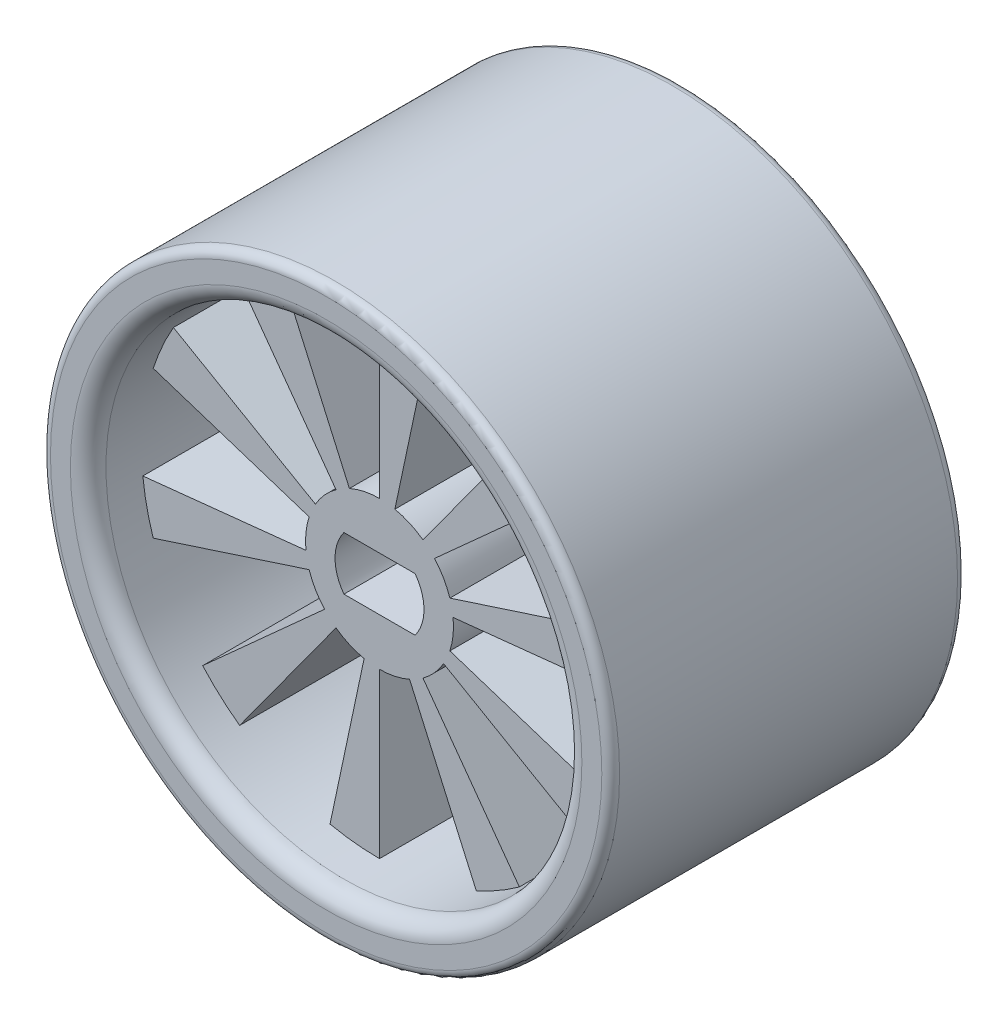
from build123d import *
from build123d.topology import SkipClean

# Parameters (mm, degrees)
SKETCH1_R           = 16
BOSS_EXTRUDE1_DEPTH = 20
CUT_EXTRUDE1_DEPTH  = 20
CUT_EXTRUDE2_DEPTH  = 20
SKETCH5_R           = 13.379368239
CUT_EXTRUDE4_DEPTH  = 3
CUT_EXTRUDE5_START  = -3
SKETCH6_R           = 13.379368239
CUT_EXTRUDE5_DEPTH  = 3
FILLET1_R           = 1
FILLET2_R           = 0.5


with BuildPart() as part:
    # Sketch1 → Boss-Extrude1 (new body)
    with BuildSketch(Plane.XY):
        Circle(SKETCH1_R)
    extrude(amount=BOSS_EXTRUDE1_DEPTH)

    # Sketch3 → Cut-Extrude1 (cut)
    with BuildSketch(Plane.XY):
        with BuildLine():
            Line((-2, 1.5), (2, 1.5))
            ThreePointArc((2, 1.5), (2.5, 0), (2, -1.5))
            Line((2, -1.5), (-2, -1.5))
            ThreePointArc((-2, -1.5), (-2.5, 0), (-2, 1.5))
        make_face()
    extrude(amount=CUT_EXTRUDE1_DEPTH, mode=Mode.SUBTRACT)

    # Sketch4 → Cut-Extrude2 (cut)
    with BuildSketch(Plane.XY):
        with BuildLine():
            Line((3.955700901, -1.285285135), (12.724535348, -4.13445216))
            ThreePointArc((12.724535348, -4.13445216), (13.30607466, -1.398524802), (13.30607466, 1.398524802))
            Line((13.30607466, 1.398524802), (4.136485151, 0.434762108))
            ThreePointArc((4.136485151, 0.434762108), (4.136485151, -0.434762108), (3.955700901, -1.285285135))
        make_face()
        with BuildLine():
            Line((3.090940028, 2.783094902), (9.942808275, 8.952544783))
            ThreePointArc((9.942808275, 8.952544783), (11.586872782, 6.68968412), (12.724535348, 4.13445216))
            Line((12.724535348, 4.13445216), (3.955700901, 1.285285135))
            ThreePointArc((3.955700901, 1.285285135), (3.602033539, 2.079635034), (3.090940028, 2.783094902))
        make_face()
        with BuildLine():
            Line((2.444757606, -3.364920169), (7.864195336, -10.82413628))
            ThreePointArc((7.864195336, -10.82413628), (9.942808275, -8.952544783), (11.586872782, -6.68968412))
            Line((11.586872782, -6.68968412), (3.602033539, -2.079635034))
            ThreePointArc((3.602033539, -2.079635034), (3.090940028, -2.783094902), (2.444757606, -3.364920169))
        make_face()
        with BuildLine():
            Line((0, -4.159270067), (0, -13.379368239))
            ThreePointArc((0, -13.379368239), (2.781727073, -13.086996943), (5.441879324, -12.222661081))
            Line((5.441879324, -12.222661081), (1.691727545, -3.799682277))
            ThreePointArc((1.691727545, -3.799682277), (0.864760872, -4.068380037), (0, -4.159270067))
        make_face()
        with BuildLine():
            Line((-2.444757606, -3.364920169), (-7.864195336, -10.82413628))
            ThreePointArc((-7.864195336, -10.82413628), (-5.441879324, -12.222661081), (-2.781727073, -13.086996943))
            Line((-2.781727073, -13.086996943), (-0.864760872, -4.068380037))
            ThreePointArc((-0.864760872, -4.068380037), (-1.691727545, -3.799682277), (-2.444757606, -3.364920169))
        make_face()
        with BuildLine():
            Line((-3.955700901, -1.285285135), (-12.724535348, -4.13445216))
            ThreePointArc((-12.724535348, -4.13445216), (-11.586872782, -6.68968412), (-9.942808275, -8.952544783))
            Line((-9.942808275, -8.952544783), (-3.090940028, -2.783094902))
            ThreePointArc((-3.090940028, -2.783094902), (-3.602033539, -2.079635034), (-3.955700901, -1.285285135))
        make_face()
        with BuildLine():
            Line((-3.955700901, 1.285285135), (-12.724535348, 4.13445216))
            ThreePointArc((-12.724535348, 4.13445216), (-13.30607466, 1.398524802), (-13.30607466, -1.398524802))
            Line((-13.30607466, -1.398524802), (-4.136485151, -0.434762108))
            ThreePointArc((-4.136485151, -0.434762108), (-4.136485151, 0.434762108), (-3.955700901, 1.285285135))
        make_face()
        with BuildLine():
            Line((-2.444757606, 3.364920169), (-7.864195336, 10.82413628))
            ThreePointArc((-7.864195336, 10.82413628), (-9.942808275, 8.952544783), (-11.586872782, 6.68968412))
            Line((-11.586872782, 6.68968412), (-3.602033539, 2.079635034))
            ThreePointArc((-3.602033539, 2.079635034), (-3.090940028, 2.783094902), (-2.444757606, 3.364920169))
        make_face()
        with BuildLine():
            Line((0, 4.159270067), (0, 13.379368239))
            ThreePointArc((0, 13.379368239), (-2.781727073, 13.086996943), (-5.441879324, 12.222661081))
            Line((-5.441879324, 12.222661081), (-1.691727545, 3.799682277))
            ThreePointArc((-1.691727545, 3.799682277), (-0.864760872, 4.068380037), (0, 4.159270067))
        make_face()
        with BuildLine():
            Line((2.444757606, 3.364920169), (7.864195336, 10.82413628))
            ThreePointArc((7.864195336, 10.82413628), (5.441879324, 12.222661081), (2.781727073, 13.086996943))
            Line((2.781727073, 13.086996943), (0.864760872, 4.068380037))
            ThreePointArc((0.864760872, 4.068380037), (1.691727545, 3.799682277), (2.444757606, 3.364920169))
        make_face()
    extrude(amount=CUT_EXTRUDE2_DEPTH, mode=Mode.SUBTRACT)

    # Sketch5 → Cut-Extrude4 (cut)
    with SkipClean():  # the faces are left unmerged after this step: merging them gives an invalid solid
        with BuildSketch(Plane.XY):
            with Locations(Location((0, 0, 0), (0, 0, 186))):
                Circle(SKETCH5_R)
        extrude(amount=CUT_EXTRUDE4_DEPTH, mode=Mode.SUBTRACT)

    # Sketch6 → Cut-Extrude5 (cut)
    with SkipClean():  # the faces are left unmerged after this step: merging them gives an invalid solid
        with BuildSketch(Plane.XY.offset(20).offset(CUT_EXTRUDE5_START)):
            Circle(SKETCH6_R)
        extrude(amount=CUT_EXTRUDE5_DEPTH, mode=Mode.SUBTRACT)

    # Fillet1
    fillet1_edges = [part.edges().sort_by_distance(p)[0] for p in [
        (13.30607466, -1.398524802, 0),
        (13.214646015, -2.092994313, 20),
    ]]
    fillet(fillet1_edges, radius=FILLET1_R)

    # Fillet2
    fillet2_edges = [part.edges().sort_by_distance(p)[0] for p in [
        (-16, 0, 0),
        (-16, 0, 20),
    ]]
    fillet(fillet2_edges, radius=FILLET2_R)


solid = part.part
